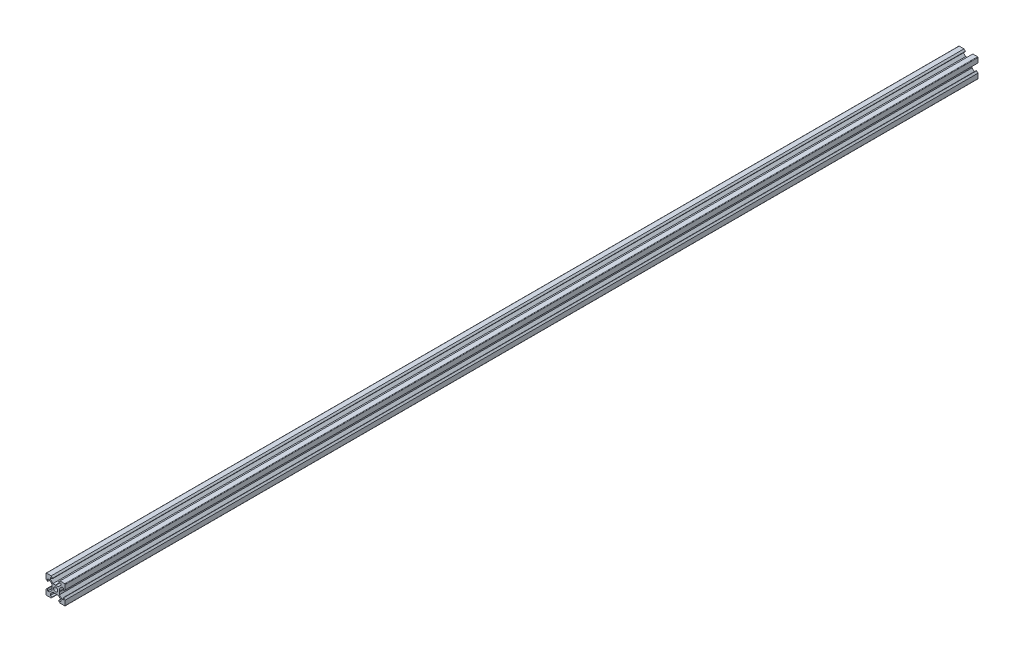
from build123d import *

# Parameters (mm, degrees)
SKETCH1_R           = 2.1
BOSS_EXTRUDE1_DEPTH = 948.5


with BuildPart() as part:
    # Sketch1 → Boss-Extrude1 (new body)
    with BuildSketch(Plane.XY):
        with BuildLine():
            Line((4.58, -10), (9.5, -10))
            ThreePointArc((9.5, -10), (9.853553391, -9.853553391), (10, -9.5))
            Line((10, -9.5), (10, -4.58))
            Line((10, -4.58), (8.545, -3.125))
            Line((8.545, -3.125), (8.2, -3.125))
            Line((8.2, -3.125), (8.2, -5.5))
            Line((8.2, -5.5), (6.560660172, -5.5))
            Line((6.560660172, -5.5), (3.9, -2.839339828))
            Line((3.9, -2.839339828), (3.9, -0.21))
            Line((3.9, -0.21), (3.69, 0))
            Line((3.69, 0), (3.9, 0.21))
            Line((3.9, 0.21), (3.9, 2.839339828))
            Line((3.9, 2.839339828), (6.560660172, 5.5))
            Line((6.560660172, 5.5), (8.2, 5.5))
            Line((8.2, 5.5), (8.2, 3.125))
            Line((8.2, 3.125), (8.545, 3.125))
            Line((8.545, 3.125), (10, 4.58))
            Line((10, 4.58), (10, 9.5))
            ThreePointArc((10, 9.5), (9.853553391, 9.853553391), (9.5, 10))
            Line((9.5, 10), (4.58, 10))
            Line((4.58, 10), (3.125, 8.545))
            Line((3.125, 8.545), (3.125, 8.2))
            Line((3.125, 8.2), (5.5, 8.2))
            Line((5.5, 8.2), (5.5, 6.560660172))
            Line((5.5, 6.560660172), (2.839339828, 3.9))
            Line((2.839339828, 3.9), (0.21, 3.9))
            Line((0.21, 3.9), (0, 3.69))
            Line((0, 3.69), (-0.21, 3.9))
            Line((-0.21, 3.9), (-2.839339828, 3.9))
            Line((-2.839339828, 3.9), (-5.5, 6.560660172))
            Line((-5.5, 6.560660172), (-5.5, 8.2))
            Line((-5.5, 8.2), (-3.125, 8.2))
            Line((-3.125, 8.2), (-3.125, 8.545))
            Line((-3.125, 8.545), (-4.58, 10))
            Line((-4.58, 10), (-9.5, 10))
            ThreePointArc((-9.5, 10), (-9.853553391, 9.853553391), (-10, 9.5))
            Line((-10, 9.5), (-10, 4.58))
            Line((-10, 4.58), (-8.545, 3.125))
            Line((-8.545, 3.125), (-8.2, 3.125))
            Line((-8.2, 3.125), (-8.2, 5.5))
            Line((-8.2, 5.5), (-6.560660172, 5.5))
            Line((-6.560660172, 5.5), (-3.9, 2.839339828))
            Line((-3.9, 2.839339828), (-3.9, 0.21))
            Line((-3.9, 0.21), (-3.69, 0))
            Line((-3.69, 0), (-3.9, -0.21))
            Line((-3.9, -0.21), (-3.9, -2.839339828))
            Line((-3.9, -2.839339828), (-6.560660172, -5.5))
            Line((-6.560660172, -5.5), (-8.2, -5.5))
            Line((-8.2, -5.5), (-8.2, -3.125))
            Line((-8.2, -3.125), (-8.545, -3.125))
            Line((-8.545, -3.125), (-10, -4.58))
            Line((-10, -4.58), (-10, -9.5))
            ThreePointArc((-10, -9.5), (-9.853553391, -9.853553391), (-9.5, -10))
            Line((-9.5, -10), (-4.58, -10))
            Line((-4.58, -10), (-3.125, -8.545))
            Line((-3.125, -8.545), (-3.125, -8.2))
            Line((-3.125, -8.2), (-5.5, -8.2))
            Line((-5.5, -8.2), (-5.5, -6.560660172))
            Line((-5.5, -6.560660172), (-2.839339828, -3.9))
            Line((-2.839339828, -3.9), (-0.21, -3.9))
            Line((-0.21, -3.9), (0, -3.69))
            Line((0, -3.69), (0.21, -3.9))
            Line((0.21, -3.9), (2.839339828, -3.9))
            Line((2.839339828, -3.9), (5.5, -6.560660172))
            Line((5.5, -6.560660172), (5.5, -8.2))
            Line((5.5, -8.2), (3.125, -8.2))
            Line((3.125, -8.2), (3.125, -8.545))
            Line((3.125, -8.545), (4.58, -10))
        make_face()
        Circle(SKETCH1_R, mode=Mode.SUBTRACT)
    extrude(amount=BOSS_EXTRUDE1_DEPTH)


solid = part.part
